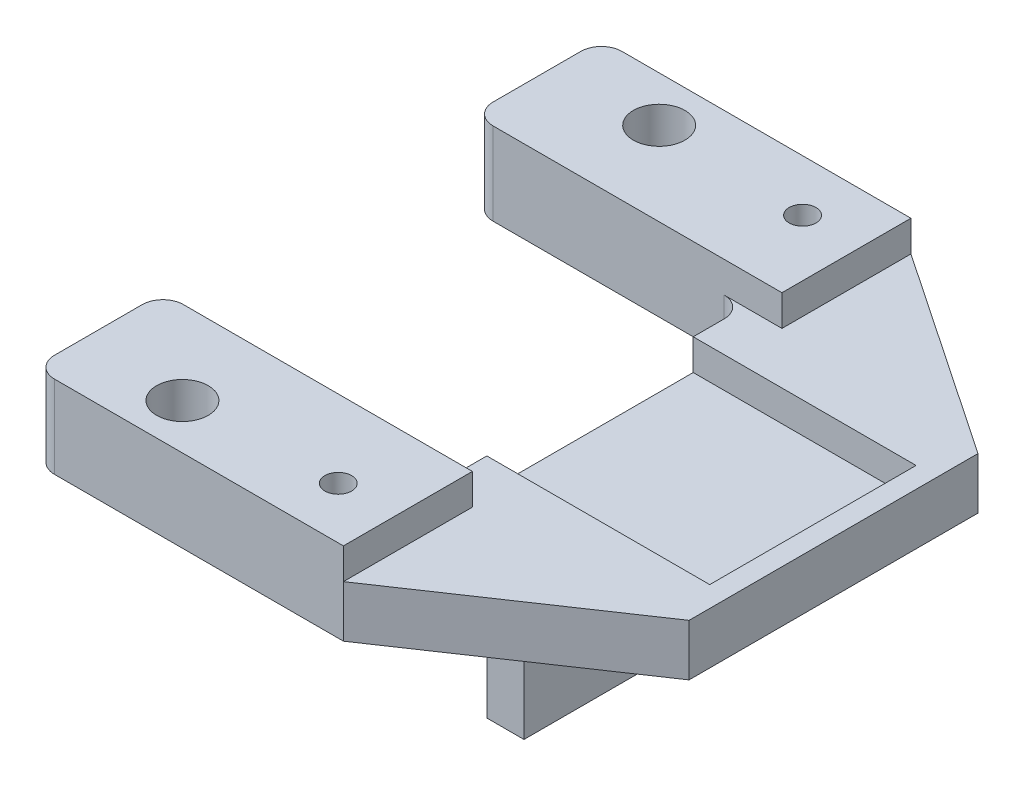
from build123d import *

# Parameters (mm, degrees)
SKETCH1_W                = 38.1
SKETCH1_H                = 69.85
SKETCH1_R                = 3.175
SKETCH1_W_2              = 25.4
SKETCH1_H_2              = 35.56
BOSS_EXTRUDE1_DEPTH      = 6.35
SKETCH2_W                = 27.432
SKETCH2_H                = 25.4
CUT_EXTRUDE1_DEPTH       = 3.81
SKETCH3_W                = 33.528
SKETCH3_H                = 38.1
CUT_EXTRUDE2_DEPTH       = 83.161835082
SKETCH9_W                = 4.572
SKETCH9_H                = 25.4
BOSS_EXTRUDE5_DEPTH      = 21.59
BOSS_EXTRUDE6_DEPTH      = 3.81
BOSS_EXTRUDE6_DEPTH_BACK = 0.000254
SKETCH10_W               = 38.1
SKETCH10_H               = 15.875
SKETCH10_R               = 3.175
CUT_EXTRUDE4_DEPTH       = 88.853896578
CUT_EXTRUDE4_DEPTH_BACK  = 10.16
SKETCH11_R               = 1.651
FILLET4_R                = 2.54
CHAMFER3_SIZE            = 1.905


with BuildPart() as part:
    # Sketch1 → Boss-Extrude1 (new body)
    # profile 1 of 4: a face of its own
    with BuildSketch(Plane(origin=(0, 0, 0), x_dir=(1, 0, 0), z_dir=(0, 1, 0))):
        with Locations((6.35, 29.337)):
            Rectangle(SKETCH1_W, SKETCH1_H)
        with Locations(Location((0, 58.674, 0), (0, 0, 270))):
            Circle(SKETCH1_R, mode=Mode.SUBTRACT)
        with Locations(Location((0, 0, 0), (0, 0, 270))):
            Circle(SKETCH1_R, mode=Mode.SUBTRACT)
    # profile 2 of 4: a face of its own
    with BuildSketch(Plane(origin=(0, 0, 0), x_dir=(1, 0, 0), z_dir=(0, 1, 0))):
        Polygon((25.4, 47.117), (50.8, 47.117), (25.4, 64.262), align=None)
    # profile 3 of 4: a face of its own
    with BuildSketch(Plane(origin=(0, 0, 0), x_dir=(1, 0, 0), z_dir=(0, 1, 0))):
        with Locations((38.1, 29.337)):
            Rectangle(SKETCH1_W_2, SKETCH1_H_2)
    # profile 4 of 4: a face of its own
    with BuildSketch(Plane(origin=(0, 0, 0), x_dir=(1, 0, 0), z_dir=(0, 1, 0))):
        Polygon((25.4, -5.588), (50.8, 11.557), (25.4, 11.557), align=None)
    extrude(amount=BOSS_EXTRUDE1_DEPTH)

    # Sketch2 → Cut-Extrude1 (cut)
    with BuildSketch(Plane(origin=(0, 6.35, 0), x_dir=(1, 0, 0), z_dir=(0, 1, 0))):
        with Locations((34.544, 29.337)):
            Rectangle(SKETCH2_W, SKETCH2_H)
    extrude(amount=-CUT_EXTRUDE1_DEPTH, mode=Mode.SUBTRACT)

    # Sketch3 → Cut-Extrude2 (cut, through all)
    with BuildSketch(Plane(origin=(0, 6.35, 0), x_dir=(1, 0, 0), z_dir=(0, 1, 0))):
        with Locations((4.064, 29.337)):
            Rectangle(SKETCH3_W, SKETCH3_H)
    extrude(amount=-CUT_EXTRUDE2_DEPTH, mode=Mode.SUBTRACT)

    # Sketch9 → Boss-Extrude5 (add)
    with BuildSketch(Plane.XZ):
        with Locations((23.114, -29.337)):
            Rectangle(SKETCH9_W, SKETCH9_H)
    extrude(amount=BOSS_EXTRUDE5_DEPTH)

    # Sketch10 → Boss-Extrude6 (add, two sides: drawn at the far end of the back side and taken through both)
    # profile 1 of 2: a face of its own
    with BuildSketch(Plane(origin=(0, 6.35, 0), x_dir=(1, 0, 0), z_dir=(0, 1, 0)).offset(-BOSS_EXTRUDE6_DEPTH_BACK)):
        with Locations((6.35, 56.3245)):
            Rectangle(SKETCH10_W, SKETCH10_H)
        with Locations(Location((0, 58.674, 0), (0, 0, 270))):
            Circle(SKETCH10_R, mode=Mode.SUBTRACT)
    # profile 2 of 2: a face of its own
    with BuildSketch(Plane(origin=(0, 6.35, 0), x_dir=(1, 0, 0), z_dir=(0, 1, 0)).offset(-BOSS_EXTRUDE6_DEPTH_BACK)):
        with Locations((6.35, 2.3495)):
            Rectangle(SKETCH10_W, SKETCH10_H)
        with Locations(Location((0, 0, 0), (0, 0, 270))):
            Circle(SKETCH10_R, mode=Mode.SUBTRACT)
    extrude(amount=BOSS_EXTRUDE6_DEPTH + BOSS_EXTRUDE6_DEPTH_BACK)

    # Sketch11 → Cut-Extrude4 (cut, two sides: drawn at the far end of the back side and taken through both)
    with BuildSketch(Plane(origin=(0, 10.16, 0), x_dir=(1, 0, 0), z_dir=(0, 1, 0)).offset(-CUT_EXTRUDE4_DEPTH_BACK)):
        with Locations(Location((18.415, 57.912, 0), (0, 0, 90))):
            Circle(SKETCH11_R)
        with Locations(Location((18.415, 0.762, 0), (0, 0, 90))):
            Circle(SKETCH11_R)
    extrude(amount=CUT_EXTRUDE4_DEPTH + CUT_EXTRUDE4_DEPTH_BACK, mode=Mode.SUBTRACT)

    # Fillet4
    fillet4_edges = [part.edges().sort_by_distance(p)[0] for p in [
        (-12.7, 5.08, 5.588),
        (-12.7, 5.08, -64.262),
        (20.828, 3.175, -48.387),
        (-12.7, 5.08, -10.287),
        (-12.7, 5.08, -48.387),
        (20.828, 3.175, -10.287),
    ]]
    fillet(fillet4_edges, radius=FILLET4_R)

    # Chamfer3
    chamfer3_edges = [part.edges().sort_by_distance(p)[0] for p in [
        (23.114, 0, -42.037),
        (25.4, 0, -29.337),
        (23.114, 0, -16.637),
    ]]
    chamfer(chamfer3_edges, length=CHAMFER3_SIZE)


solid = part.part
